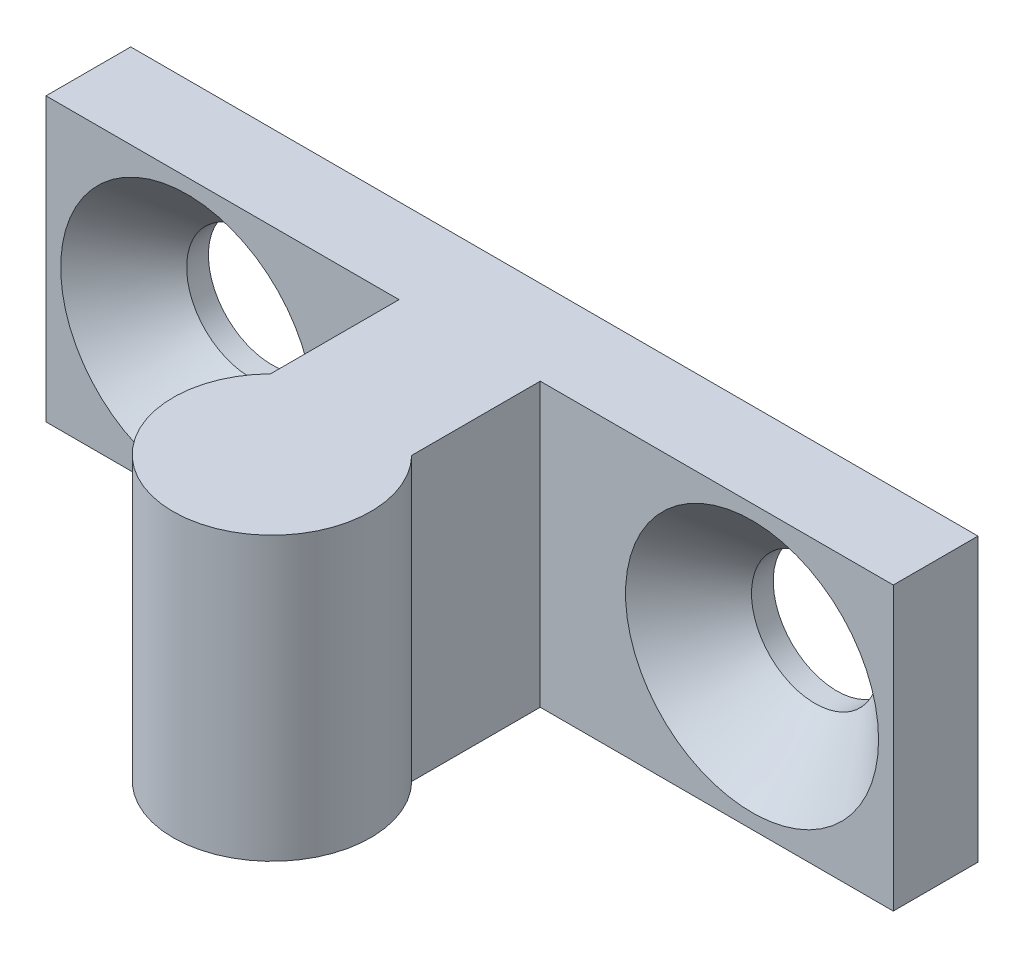
from build123d import *

# Parameters (mm, degrees)
SKETCH_1_W                  = 30
SKETCH_1_H                  = 3
EXTRUDE_1_DEPTH             = 5
HOLE_WIZARD_M4_1_AT_2_COUNT = 2
HOLE_WIZARD_M4_1_AT_2_PITCH = 20


with BuildPart() as part:
    # 草图1 → 拉伸1 (new, symmetric)
    with BuildSketch(Plane(origin=(0, 0, 0), x_dir=(1, 0, 0), z_dir=(0, 1, 0))):
        with BuildLine():
            Line((2.5, -3), (-2.5, -3))
            Line((-2.5, -3), (-2.5, -7.550510257))
            ThreePointArc((-2.5, -7.550510257), (0, -13.5), (2.5, -7.550510257))
            Line((2.5, -7.550510257), (2.5, -3))
        make_face()
        with Locations((0, -1.5)):
            Rectangle(SKETCH_1_W, SKETCH_1_H)
    extrude(amount=EXTRUDE_1_DEPTH, both=True)

    # 草图2 → M4 六角凹锥坑螺钉的锥形沉头孔1 (revolve, cut)
    with BuildSketch(Plane(origin=(-10, 0, 3), x_dir=(0, -1, 0), z_dir=(1, 0, 0))):
        Polygon((0, 0), (0, 3), (2.25, 3), (2.25, 2.23), (4.48, 0), align=None)
    hole_wizard_m4_1 = revolve(axis=Axis((-10, 0, 9.35), (0, 0, -1)), mode=Mode.SUBTRACT)

    # M4 六角凹锥坑螺钉的锥形沉头孔1 at 2: M4 六角凹锥坑螺钉的锥形沉头孔1 ×2
    with Locations(*[(i * HOLE_WIZARD_M4_1_AT_2_PITCH, 0, 0) for i in range(1, HOLE_WIZARD_M4_1_AT_2_COUNT)]):
        add(hole_wizard_m4_1, mode=Mode.SUBTRACT)


solid = part.part
